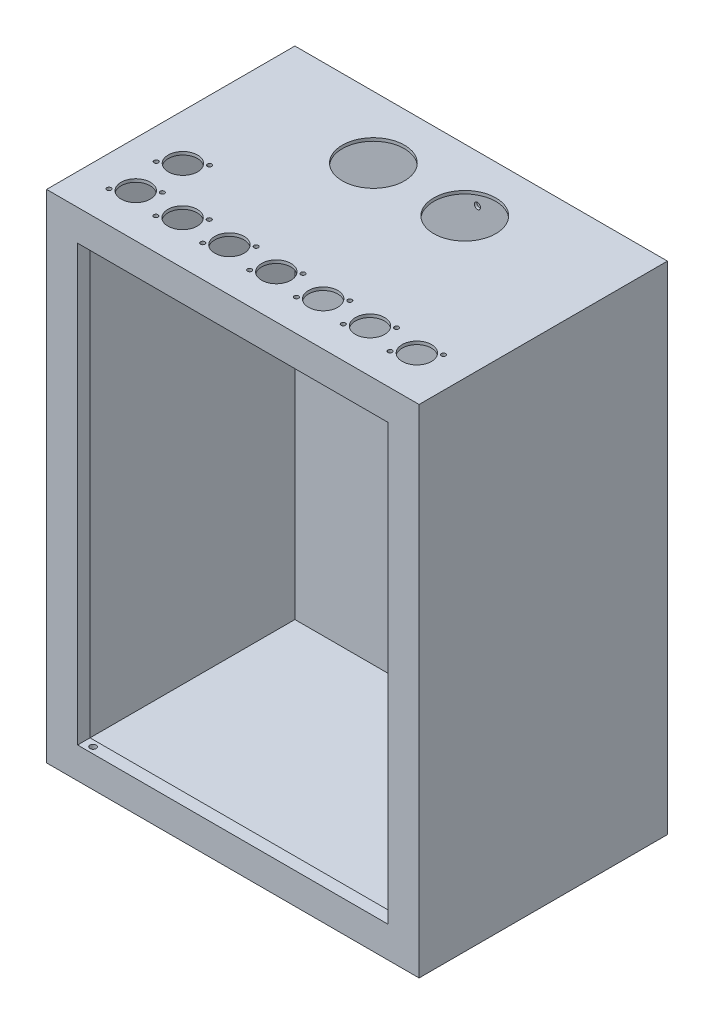
from build123d import *

# Parameters (mm, degrees)
SKETCH1_W                = 300
SKETCH1_H                = 200
BOSS_EXTRUDE1_DEPTH      = 400
SKETCH2_W                = 294
SKETCH2_H                = 394
CUT_EXTRUDE1_DEPTH       = 197
SKETCH3_W                = 294
SKETCH3_H                = 394
SKETCH3_W_2              = 250
SKETCH3_H_2              = 350
BOSS_EXTRUDE2_DEPTH      = 10
SKETCH4_R                = 2.5
CUT_EXTRUDE2_DEPTH       = 2
SKETCH5_W                = 294
SKETCH5_H                = 187
CUT_EXTRUDE3_DEPTH       = 0.5
CUT_EXTRUDE4_REACH       = 440.748
SKETCH6_R                = 11.8
CUT_EXTRUDE5_REACH       = 440.748
SKETCH7_R                = 25
CUT_EXTRUDE7_REACH       = 440.748
SKETCH8_R                = 1.75
CUT_EXTRUDE8_REACH       = 440.748
SKETCH9_R                = 1.75
CUT_EXTRUDE9_REACH       = 440.748
SKETCH11_R               = 1.75
CUT_EXTRUDE10_DEPTH      = 355
CUT_EXTRUDE10_DEPTH_BACK = 5
SKETCH12_R               = 2.5


with BuildPart() as part:
    # Sketch1 → Boss-Extrude1 (new body)
    with BuildSketch(Plane(origin=(0, 0, 0), x_dir=(1, 0, 0), z_dir=(0, 1, 0))):
        Rectangle(SKETCH1_W, SKETCH1_H)
    extrude(amount=BOSS_EXTRUDE1_DEPTH)

    # Sketch2 → Cut-Extrude1 (cut)
    with BuildSketch(Plane.XY.offset(100)):
        with Locations((0, 200)):
            Rectangle(SKETCH2_W, SKETCH2_H)
    extrude(amount=-CUT_EXTRUDE1_DEPTH, mode=Mode.SUBTRACT)

    # Sketch3 → Boss-Extrude2 (add)
    with BuildSketch(Plane.XY.offset(100)):
        with Locations((0, 200)):
            Rectangle(SKETCH3_W, SKETCH3_H)
        with Locations((0, 200)):
            Rectangle(SKETCH3_W_2, SKETCH3_H_2, mode=Mode.SUBTRACT)
    extrude(amount=-BOSS_EXTRUDE2_DEPTH)

    # Sketch4 → Cut-Extrude2 (cut)
    with BuildSketch(Plane.XY.offset(-97)):
        with Locations((0, 365)):
            Circle(SKETCH4_R)
        with Locations(Location((0, 35, 0), (0, 0, 180))):
            Circle(SKETCH4_R)
    extrude(amount=-CUT_EXTRUDE2_DEPTH, mode=Mode.SUBTRACT)

    # Sketch5 → Cut-Extrude3 (cut)
    with BuildSketch(Plane.XZ.offset(-397)):
        with Locations((0, -3.5)):
            Rectangle(SKETCH5_W, SKETCH5_H)
    extrude(amount=-CUT_EXTRUDE3_DEPTH, mode=Mode.SUBTRACT)

    # Sketch6 → Cut-Extrude4 (cut, up to next)
    with BuildSketch(Plane(origin=(0, 400, 0), x_dir=(1, 0, 0), z_dir=(0, 1, 0)), mode=Mode.PRIVATE) as cut_extrude4_sk1:
        with Locations(Location((-113.2, -65, 0), (0, 0, 270))):
            Circle(SKETCH6_R)
    cut_extrude4_tool1 = extrude(cut_extrude4_sk1.sketch, amount=-CUT_EXTRUDE4_REACH, mode=Mode.PRIVATE) & part.part
    # Sketch6 → Cut-Extrude4 (cut, up to next)
    with BuildSketch(Plane(origin=(0, 400, 0), x_dir=(1, 0, 0), z_dir=(0, 1, 0)), mode=Mode.PRIVATE) as cut_extrude4_sk2:
        with Locations(Location((-75.466666667, -65, 0), (0, 0, 270))):
            Circle(SKETCH6_R)
    cut_extrude4_tool2 = extrude(cut_extrude4_sk2.sketch, amount=-CUT_EXTRUDE4_REACH, mode=Mode.PRIVATE) & part.part
    # Sketch6 → Cut-Extrude4 (cut, up to next)
    with BuildSketch(Plane(origin=(0, 400, 0), x_dir=(1, 0, 0), z_dir=(0, 1, 0)), mode=Mode.PRIVATE) as cut_extrude4_sk3:
        with Locations(Location((-37.733333333, -65, 0), (0, 0, 270))):
            Circle(SKETCH6_R)
    cut_extrude4_tool3 = extrude(cut_extrude4_sk3.sketch, amount=-CUT_EXTRUDE4_REACH, mode=Mode.PRIVATE) & part.part
    # Sketch6 → Cut-Extrude4 (cut, up to next)
    with BuildSketch(Plane(origin=(0, 400, 0), x_dir=(1, 0, 0), z_dir=(0, 1, 0)), mode=Mode.PRIVATE) as cut_extrude4_sk4:
        with Locations(Location((0, -65, 0), (0, 0, 270))):
            Circle(SKETCH6_R)
    cut_extrude4_tool4 = extrude(cut_extrude4_sk4.sketch, amount=-CUT_EXTRUDE4_REACH, mode=Mode.PRIVATE) & part.part
    # Sketch6 → Cut-Extrude4 (cut, up to next)
    with BuildSketch(Plane(origin=(0, 400, 0), x_dir=(1, 0, 0), z_dir=(0, 1, 0)), mode=Mode.PRIVATE) as cut_extrude4_sk5:
        with Locations(Location((37.733333333, -65, 0), (0, 0, 270))):
            Circle(SKETCH6_R)
    cut_extrude4_tool5 = extrude(cut_extrude4_sk5.sketch, amount=-CUT_EXTRUDE4_REACH, mode=Mode.PRIVATE) & part.part
    # Sketch6 → Cut-Extrude4 (cut, up to next)
    with BuildSketch(Plane(origin=(0, 400, 0), x_dir=(1, 0, 0), z_dir=(0, 1, 0)), mode=Mode.PRIVATE) as cut_extrude4_sk6:
        with Locations(Location((75.466666667, -65, 0), (0, 0, 270))):
            Circle(SKETCH6_R)
    cut_extrude4_tool6 = extrude(cut_extrude4_sk6.sketch, amount=-CUT_EXTRUDE4_REACH, mode=Mode.PRIVATE) & part.part
    # Sketch6 → Cut-Extrude4 (cut, up to next)
    with BuildSketch(Plane(origin=(0, 400, 0), x_dir=(1, 0, 0), z_dir=(0, 1, 0)), mode=Mode.PRIVATE) as cut_extrude4_sk7:
        with Locations(Location((113.2, -65, 0), (0, 0, 270))):
            Circle(SKETCH6_R)
    cut_extrude4_tool7 = extrude(cut_extrude4_sk7.sketch, amount=-CUT_EXTRUDE4_REACH, mode=Mode.PRIVATE) & part.part
    # Sketch6 → Cut-Extrude4 (cut, up to next)
    with BuildSketch(Plane(origin=(0, 400, 0), x_dir=(1, 0, 0), z_dir=(0, 1, 0)), mode=Mode.PRIVATE) as cut_extrude4_sk8:
        with Locations(Location((-113.2, -27, 0), (0, 0, 270))):
            Circle(SKETCH6_R)
    cut_extrude4_tool8 = extrude(cut_extrude4_sk8.sketch, amount=-CUT_EXTRUDE4_REACH, mode=Mode.PRIVATE) & part.part
    add(cut_extrude4_tool1.solids().sort_by_distance((-113.2, 400, 65))[0], mode=Mode.SUBTRACT)
    add(cut_extrude4_tool2.solids().sort_by_distance((-75.466667, 400, 65))[0], mode=Mode.SUBTRACT)
    add(cut_extrude4_tool3.solids().sort_by_distance((-37.733333, 400, 65))[0], mode=Mode.SUBTRACT)
    add(cut_extrude4_tool4.solids().sort_by_distance((0, 400, 65))[0], mode=Mode.SUBTRACT)
    add(cut_extrude4_tool5.solids().sort_by_distance((37.733333, 400, 65))[0], mode=Mode.SUBTRACT)
    add(cut_extrude4_tool6.solids().sort_by_distance((75.466667, 400, 65))[0], mode=Mode.SUBTRACT)
    add(cut_extrude4_tool7.solids().sort_by_distance((113.2, 400, 65))[0], mode=Mode.SUBTRACT)
    add(cut_extrude4_tool8.solids().sort_by_distance((-113.2, 400, 27))[0], mode=Mode.SUBTRACT)

    # Sketch7 → Cut-Extrude5 (cut, up to next)
    with BuildSketch(Plane(origin=(0, 400, 0), x_dir=(1, 0, 0), z_dir=(0, 1, 0)), mode=Mode.PRIVATE) as cut_extrude5_sk1:
        with Locations(Location((-36.8, 50, 0), (0, 0, 270))):
            Circle(SKETCH7_R)
    cut_extrude5_tool1 = extrude(cut_extrude5_sk1.sketch, amount=-CUT_EXTRUDE5_REACH, mode=Mode.PRIVATE) & part.part
    # Sketch7 → Cut-Extrude5 (cut, up to next)
    with BuildSketch(Plane(origin=(0, 400, 0), x_dir=(1, 0, 0), z_dir=(0, 1, 0)), mode=Mode.PRIVATE) as cut_extrude5_sk2:
        with Locations((36.8, 50)):
            Circle(SKETCH7_R)
    cut_extrude5_tool2 = extrude(cut_extrude5_sk2.sketch, amount=-CUT_EXTRUDE5_REACH, mode=Mode.PRIVATE) & part.part
    add(cut_extrude5_tool1.solids().sort_by_distance((-36.8, 400, -50))[0], mode=Mode.SUBTRACT)
    add(cut_extrude5_tool2.solids().sort_by_distance((36.8, 400, -50))[0], mode=Mode.SUBTRACT)

    # Sketch8 → Cut-Extrude7 (cut, up to next)
    with BuildSketch(Plane(origin=(0, 400, 0), x_dir=(1, 0, 0), z_dir=(0, 1, 0)), mode=Mode.PRIVATE) as cut_extrude7_sk1:
        with Locations(Location((-125.2, -74.5, 0), (0, 0, 270))):
            Circle(SKETCH8_R)
    cut_extrude7_tool1 = extrude(cut_extrude7_sk1.sketch, amount=-CUT_EXTRUDE7_REACH, mode=Mode.PRIVATE) & part.part
    # Sketch8 → Cut-Extrude7 (cut, up to next)
    with BuildSketch(Plane(origin=(0, 400, 0), x_dir=(1, 0, 0), z_dir=(0, 1, 0)), mode=Mode.PRIVATE) as cut_extrude7_sk2:
        with Locations(Location((-87.47, -74.5, 0), (0, 0, 270))):
            Circle(SKETCH8_R)
    cut_extrude7_tool2 = extrude(cut_extrude7_sk2.sketch, amount=-CUT_EXTRUDE7_REACH, mode=Mode.PRIVATE) & part.part
    # Sketch8 → Cut-Extrude7 (cut, up to next)
    with BuildSketch(Plane(origin=(0, 400, 0), x_dir=(1, 0, 0), z_dir=(0, 1, 0)), mode=Mode.PRIVATE) as cut_extrude7_sk3:
        with Locations(Location((-49.74, -74.5, 0), (0, 0, 270))):
            Circle(SKETCH8_R)
    cut_extrude7_tool3 = extrude(cut_extrude7_sk3.sketch, amount=-CUT_EXTRUDE7_REACH, mode=Mode.PRIVATE) & part.part
    # Sketch8 → Cut-Extrude7 (cut, up to next)
    with BuildSketch(Plane(origin=(0, 400, 0), x_dir=(1, 0, 0), z_dir=(0, 1, 0)), mode=Mode.PRIVATE) as cut_extrude7_sk4:
        with Locations(Location((-12.01, -74.5, 0), (0, 0, 270))):
            Circle(SKETCH8_R)
    cut_extrude7_tool4 = extrude(cut_extrude7_sk4.sketch, amount=-CUT_EXTRUDE7_REACH, mode=Mode.PRIVATE) & part.part
    # Sketch8 → Cut-Extrude7 (cut, up to next)
    with BuildSketch(Plane(origin=(0, 400, 0), x_dir=(1, 0, 0), z_dir=(0, 1, 0)), mode=Mode.PRIVATE) as cut_extrude7_sk5:
        with Locations(Location((25.72, -74.5, 0), (0, 0, 270))):
            Circle(SKETCH8_R)
    cut_extrude7_tool5 = extrude(cut_extrude7_sk5.sketch, amount=-CUT_EXTRUDE7_REACH, mode=Mode.PRIVATE) & part.part
    # Sketch8 → Cut-Extrude7 (cut, up to next)
    with BuildSketch(Plane(origin=(0, 400, 0), x_dir=(1, 0, 0), z_dir=(0, 1, 0)), mode=Mode.PRIVATE) as cut_extrude7_sk6:
        with Locations(Location((63.45, -74.5, 0), (0, 0, 270))):
            Circle(SKETCH8_R)
    cut_extrude7_tool6 = extrude(cut_extrude7_sk6.sketch, amount=-CUT_EXTRUDE7_REACH, mode=Mode.PRIVATE) & part.part
    # Sketch8 → Cut-Extrude7 (cut, up to next)
    with BuildSketch(Plane(origin=(0, 400, 0), x_dir=(1, 0, 0), z_dir=(0, 1, 0)), mode=Mode.PRIVATE) as cut_extrude7_sk7:
        with Locations(Location((101.18, -74.5, 0), (0, 0, 270))):
            Circle(SKETCH8_R)
    cut_extrude7_tool7 = extrude(cut_extrude7_sk7.sketch, amount=-CUT_EXTRUDE7_REACH, mode=Mode.PRIVATE) & part.part
    add(cut_extrude7_tool1.solids().sort_by_distance((-125.2, 400, 74.5))[0], mode=Mode.SUBTRACT)
    add(cut_extrude7_tool2.solids().sort_by_distance((-87.47, 400, 74.5))[0], mode=Mode.SUBTRACT)
    add(cut_extrude7_tool3.solids().sort_by_distance((-49.74, 400, 74.5))[0], mode=Mode.SUBTRACT)
    add(cut_extrude7_tool4.solids().sort_by_distance((-12.01, 400, 74.5))[0], mode=Mode.SUBTRACT)
    add(cut_extrude7_tool5.solids().sort_by_distance((25.72, 400, 74.5))[0], mode=Mode.SUBTRACT)
    add(cut_extrude7_tool6.solids().sort_by_distance((63.45, 400, 74.5))[0], mode=Mode.SUBTRACT)
    add(cut_extrude7_tool7.solids().sort_by_distance((101.18, 400, 74.5))[0], mode=Mode.SUBTRACT)

    # Sketch9 → Cut-Extrude8 (cut, up to next)
    with BuildSketch(Plane(origin=(0, 400, 0), x_dir=(1, 0, 0), z_dir=(0, 1, 0)), mode=Mode.PRIVATE) as cut_extrude8_sk1:
        with Locations(Location((-101.2, -55.5, 0), (0, 0, 270))):
            Circle(SKETCH9_R)
    cut_extrude8_tool1 = extrude(cut_extrude8_sk1.sketch, amount=-CUT_EXTRUDE8_REACH, mode=Mode.PRIVATE) & part.part
    # Sketch9 → Cut-Extrude8 (cut, up to next)
    with BuildSketch(Plane(origin=(0, 400, 0), x_dir=(1, 0, 0), z_dir=(0, 1, 0)), mode=Mode.PRIVATE) as cut_extrude8_sk2:
        with Locations(Location((-63.47, -55.5, 0), (0, 0, 270))):
            Circle(SKETCH9_R)
    cut_extrude8_tool2 = extrude(cut_extrude8_sk2.sketch, amount=-CUT_EXTRUDE8_REACH, mode=Mode.PRIVATE) & part.part
    # Sketch9 → Cut-Extrude8 (cut, up to next)
    with BuildSketch(Plane(origin=(0, 400, 0), x_dir=(1, 0, 0), z_dir=(0, 1, 0)), mode=Mode.PRIVATE) as cut_extrude8_sk3:
        with Locations(Location((-25.74, -55.5, 0), (0, 0, 270))):
            Circle(SKETCH9_R)
    cut_extrude8_tool3 = extrude(cut_extrude8_sk3.sketch, amount=-CUT_EXTRUDE8_REACH, mode=Mode.PRIVATE) & part.part
    # Sketch9 → Cut-Extrude8 (cut, up to next)
    with BuildSketch(Plane(origin=(0, 400, 0), x_dir=(1, 0, 0), z_dir=(0, 1, 0)), mode=Mode.PRIVATE) as cut_extrude8_sk4:
        with Locations(Location((11.99, -55.5, 0), (0, 0, 270))):
            Circle(SKETCH9_R)
    cut_extrude8_tool4 = extrude(cut_extrude8_sk4.sketch, amount=-CUT_EXTRUDE8_REACH, mode=Mode.PRIVATE) & part.part
    # Sketch9 → Cut-Extrude8 (cut, up to next)
    with BuildSketch(Plane(origin=(0, 400, 0), x_dir=(1, 0, 0), z_dir=(0, 1, 0)), mode=Mode.PRIVATE) as cut_extrude8_sk5:
        with Locations(Location((49.72, -55.5, 0), (0, 0, 270))):
            Circle(SKETCH9_R)
    cut_extrude8_tool5 = extrude(cut_extrude8_sk5.sketch, amount=-CUT_EXTRUDE8_REACH, mode=Mode.PRIVATE) & part.part
    # Sketch9 → Cut-Extrude8 (cut, up to next)
    with BuildSketch(Plane(origin=(0, 400, 0), x_dir=(1, 0, 0), z_dir=(0, 1, 0)), mode=Mode.PRIVATE) as cut_extrude8_sk6:
        with Locations(Location((87.45, -55.5, 0), (0, 0, 270))):
            Circle(SKETCH9_R)
    cut_extrude8_tool6 = extrude(cut_extrude8_sk6.sketch, amount=-CUT_EXTRUDE8_REACH, mode=Mode.PRIVATE) & part.part
    # Sketch9 → Cut-Extrude8 (cut, up to next)
    with BuildSketch(Plane(origin=(0, 400, 0), x_dir=(1, 0, 0), z_dir=(0, 1, 0)), mode=Mode.PRIVATE) as cut_extrude8_sk7:
        with Locations(Location((125.18, -55.5, 0), (0, 0, 270))):
            Circle(SKETCH9_R)
    cut_extrude8_tool7 = extrude(cut_extrude8_sk7.sketch, amount=-CUT_EXTRUDE8_REACH, mode=Mode.PRIVATE) & part.part
    add(cut_extrude8_tool1.solids().sort_by_distance((-101.2, 400, 55.5))[0], mode=Mode.SUBTRACT)
    add(cut_extrude8_tool2.solids().sort_by_distance((-63.47, 400, 55.5))[0], mode=Mode.SUBTRACT)
    add(cut_extrude8_tool3.solids().sort_by_distance((-25.74, 400, 55.5))[0], mode=Mode.SUBTRACT)
    add(cut_extrude8_tool4.solids().sort_by_distance((11.99, 400, 55.5))[0], mode=Mode.SUBTRACT)
    add(cut_extrude8_tool5.solids().sort_by_distance((49.72, 400, 55.5))[0], mode=Mode.SUBTRACT)
    add(cut_extrude8_tool6.solids().sort_by_distance((87.45, 400, 55.5))[0], mode=Mode.SUBTRACT)
    add(cut_extrude8_tool7.solids().sort_by_distance((125.18, 400, 55.5))[0], mode=Mode.SUBTRACT)

    # Sketch11 → Cut-Extrude9 (cut, up to next)
    with BuildSketch(Plane(origin=(0, 400, 0), x_dir=(1, 0, 0), z_dir=(0, 1, 0)), mode=Mode.PRIVATE) as cut_extrude9_sk1:
        with Locations((-125.2, -36.5)):
            Circle(SKETCH11_R)
    cut_extrude9_tool1 = extrude(cut_extrude9_sk1.sketch, amount=-CUT_EXTRUDE9_REACH, mode=Mode.PRIVATE) & part.part
    # Sketch11 → Cut-Extrude9 (cut, up to next)
    with BuildSketch(Plane(origin=(0, 400, 0), x_dir=(1, 0, 0), z_dir=(0, 1, 0)), mode=Mode.PRIVATE) as cut_extrude9_sk2:
        with Locations((-101.2, -17.5)):
            Circle(SKETCH11_R)
    cut_extrude9_tool2 = extrude(cut_extrude9_sk2.sketch, amount=-CUT_EXTRUDE9_REACH, mode=Mode.PRIVATE) & part.part
    add(cut_extrude9_tool1.solids().sort_by_distance((-125.2, 400, 36.5))[0], mode=Mode.SUBTRACT)
    add(cut_extrude9_tool2.solids().sort_by_distance((-101.2, 400, 17.5))[0], mode=Mode.SUBTRACT)

    # Sketch12 → Cut-Extrude10 (cut, two sides: drawn at the far end of the back side and taken through both)
    with BuildSketch(Plane.XZ.offset(-375).offset(-CUT_EXTRUDE10_DEPTH_BACK)):
        with Locations(Location((-117.5, 95, 0), (0, 0, 270))):
            Circle(SKETCH12_R)
    extrude(amount=CUT_EXTRUDE10_DEPTH + CUT_EXTRUDE10_DEPTH_BACK, mode=Mode.SUBTRACT)


solid = part.part
